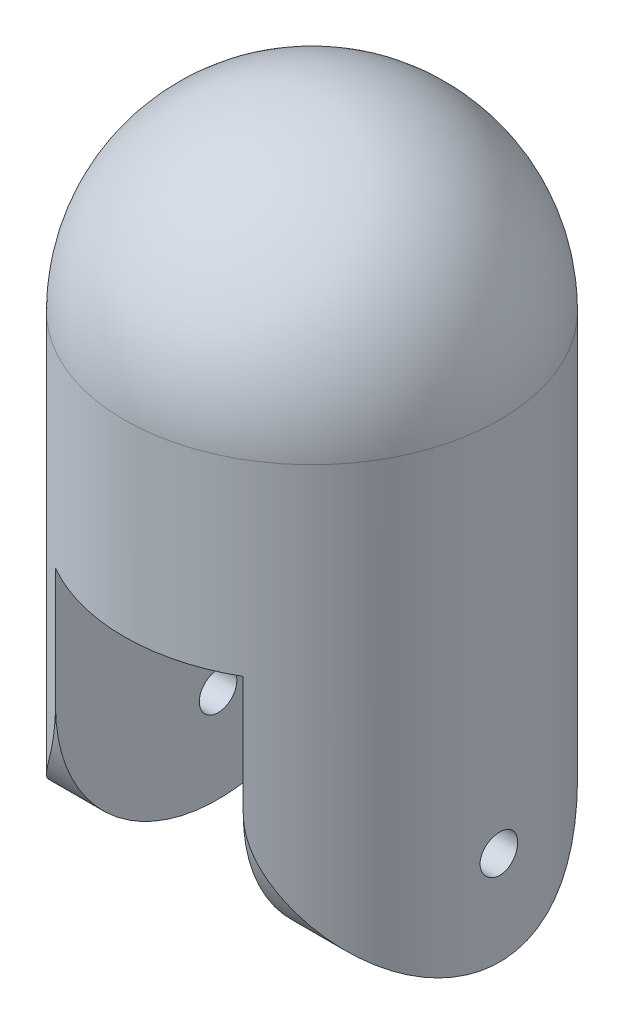
from build123d import *

# Parameters (mm, degrees)
SKETCH1_R                            = 5
BOSS_EXTRUDE1_DEPTH                  = 5
BOSS_EXTRUDE3_DEPTH                  = 7.5
CUT_EXTRUDE3_DEPTH                   = 7.5
CUT_EXTRUDE3_DEPTH_BACK              = 7.5
F_95_0_03937008_DIAMETER_HOLE1_D     = 1.000000032
F_95_0_03937008_DIAMETER_HOLE1_DEPTH = 2.5
F_94_0_03937008_DIAMETER_HOLE1_D     = 1.000000032


with BuildPart() as part:
    # Sketch1 → Boss-Extrude1 (new body)
    with BuildSketch(Plane(origin=(0, 0, 0), x_dir=(1, 0, 0), z_dir=(0, 1, 0))):
        with Locations(Location((0, 0, 0), (0, 0, 270))):
            Circle(SKETCH1_R)
    extrude(amount=-BOSS_EXTRUDE1_DEPTH)

    # Sketch2 → Boss-Extrude3 (add)
    with BuildSketch(Plane.XZ.offset(5)):
        with BuildLine():
            Line((-2.5, 4.330127019), (-2.5, -4.330127019))
            ThreePointArc((-2.5, -4.330127019), (-5, 0), (-2.5, 4.330127019))
        make_face()
        with BuildLine():
            Line((2.5, 4.330127019), (2.5, -4.330127019))
            ThreePointArc((2.5, -4.330127019), (5, 0), (2.5, 4.330127019))
        make_face()
    extrude(amount=BOSS_EXTRUDE3_DEPTH)

    # Sketch3 → Cut-Extrude3 (cut, two sides: drawn at the far end of the back side and taken through both)
    with BuildSketch(Plane(origin=(-2.5, 0, 0), x_dir=(0, 0, -1), z_dir=(1, 0, 0)).offset(-CUT_EXTRUDE3_DEPTH_BACK)):
        with BuildLine():
            Line((4.330127019, -8.16987298), (5.6827841, -8.16987298))
            Line((5.6827841, -8.16987298), (5.6827841, -17.335433659))
            Line((5.6827841, -17.335433659), (-5.198770312, -17.335433659))
            Line((-5.198770312, -17.335433659), (-5.198770312, -8.16987298))
            Line((-5.198770312, -8.16987298), (-4.330127019, -8.16987298))
            ThreePointArc((-4.330127019, -8.16987298), (-3.061862179, -11.231735159), (0, -12.5))
            ThreePointArc((0, -12.5), (3.061862179, -11.231735159), (4.330127019, -8.16987298))
        make_face()
    extrude(amount=CUT_EXTRUDE3_DEPTH + CUT_EXTRUDE3_DEPTH_BACK, mode=Mode.SUBTRACT)

    # #95 (0.03937008) Diameter Hole1
    with Locations(Plane(origin=(2.5, -10, 0), x_dir=(0, 0, -1), z_dir=(-1, 0, 0))):
        with Locations((0, 0)):
            Hole(F_95_0_03937008_DIAMETER_HOLE1_D / 2, depth=F_95_0_03937008_DIAMETER_HOLE1_DEPTH)

    # #94 (0.03937008) Diameter Hole1 (through all)
    with Locations(Plane(origin=(2.5, -10, 0), x_dir=(0, 0, 1), z_dir=(1, 0, 0))):
        with Locations((0, 0)):
            Hole(F_94_0_03937008_DIAMETER_HOLE1_D / 2)

    # Sketch7 → Revolve1 (revolve)
    with BuildSketch(Plane.XY):
        with BuildLine():
            Line((0, 0), (0, 5))
            ThreePointArc((0, 5), (-3.535533906, 3.535533906), (-5, 0))
            Line((-5, 0), (0, 0))
        make_face()
    revolve(axis=Axis((0, 0, 0), (0, 1, 0)))


solid = part.part
